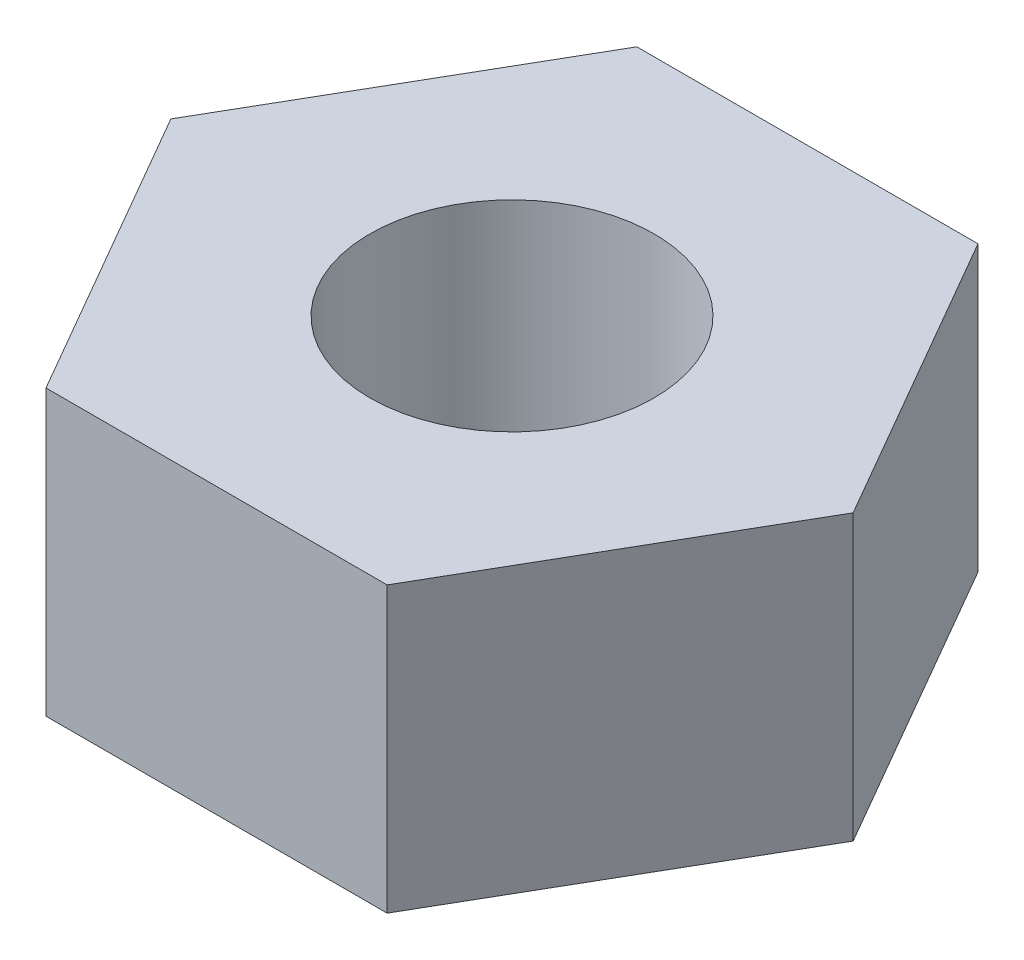
from build123d import *

# Parameters (mm, degrees)
BOSS_EXTRUDE1_DEPTH = 10
SKETCH2_R           = 5
CUT_EXTRUDE1_DEPTH  = 10


with BuildPart() as part:
    # Sketch1 → Boss-Extrude1 (new body)
    with BuildSketch(Plane(origin=(0, 0, 0), x_dir=(1, 0, 0), z_dir=(0, 1, 0))):
        Polygon((6, 10.392304845), (-6, 10.392304845), (-12, 0), (-6, -10.392304845), (6, -10.392304845), (12, 0), align=None)
    extrude(amount=BOSS_EXTRUDE1_DEPTH)

    # Sketch2 → Cut-Extrude1 (cut)
    with BuildSketch(Plane(origin=(0, 10, 0), x_dir=(1, 0, 0), z_dir=(0, 1, 0))):
        with Locations(Location((0, 0, 0), (0, 0, 270))):
            Circle(SKETCH2_R)
    extrude(amount=-CUT_EXTRUDE1_DEPTH, mode=Mode.SUBTRACT)


solid = part.part
